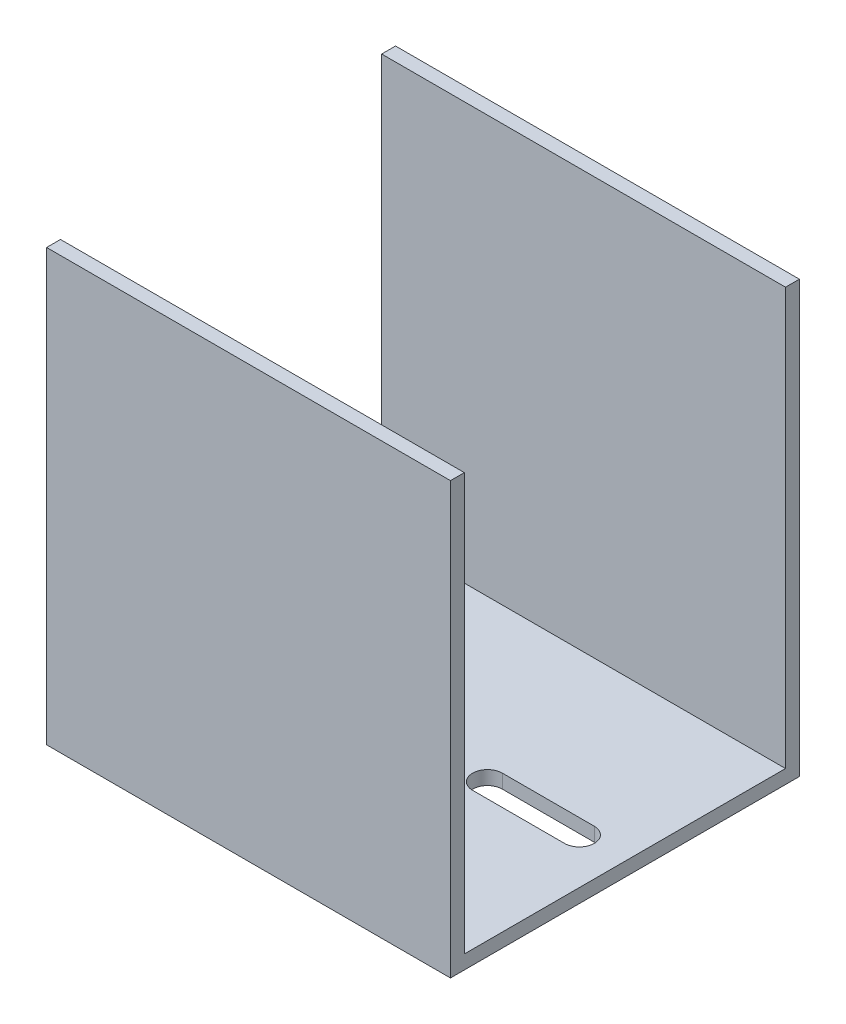
from build123d import *

# Parameters (mm, degrees)
SKETCH1_W           = 139.7
SKETCH1_H           = 111.1
SKETCH1_R           = 5.15
BOSS_EXTRUDE1_DEPTH = 4.8
SKETCH1_4_W         = 139.7
SKETCH1_4_H         = 4.8
BOSS_EXTRUDE2_DEPTH = 149


with BuildPart() as part:
    # Sketch1 → Boss-Extrude1 (new body)
    with BuildSketch(Plane(origin=(0, 0, 0), x_dir=(1, 0, 0), z_dir=(0, 1, 0))):
        with Locations((69.85, -60.35)):
            Rectangle(SKETCH1_W, SKETCH1_H)
        with BuildLine():
            ThreePointArc((7.55, -87.3), (12.7, -82.15), (17.85, -87.3))
            Line((17.85, -87.3), (17.85, -100))
            ThreePointArc((17.85, -100), (12.7, -105.15), (7.55, -100))
            Line((7.55, -100), (7.55, -87.3))
        make_face(mode=Mode.SUBTRACT)
        with Locations((12.7, -60.3)):
            Circle(SKETCH1_R, mode=Mode.SUBTRACT)
        with Locations((39.7, -60.3)):
            Circle(SKETCH1_R, mode=Mode.SUBTRACT)
        with BuildLine():
            Line((7.55, -33.3), (7.55, -20.6))
            ThreePointArc((7.55, -20.6), (12.7, -15.45), (17.85, -20.6))
            Line((17.85, -20.6), (17.85, -33.3))
            ThreePointArc((17.85, -33.3), (12.7, -38.45), (7.55, -33.3))
        make_face(mode=Mode.SUBTRACT)
        with BuildLine():
            ThreePointArc((92.1, -65.45), (86.95, -60.3), (92.1, -55.15))
            Line((92.1, -55.15), (123.9, -55.15))
            ThreePointArc((123.9, -55.15), (127.541599923, -56.658400077), (129.05, -60.3))
            ThreePointArc((129.05, -60.3), (127.541599923, -63.941599923), (123.9, -65.45))
            Line((123.9, -65.45), (92.1, -65.45))
        make_face(mode=Mode.SUBTRACT)
    extrude(amount=BOSS_EXTRUDE1_DEPTH)

    # Sketch1<4> → Boss-Extrude2 (add)
    with BuildSketch(Plane(origin=(0, 0, 0), x_dir=(1, 0, 0), z_dir=(0, 1, 0))):
        with Locations((69.85, -2.4)):
            Rectangle(SKETCH1_4_W, SKETCH1_4_H)
        with Locations((69.85, -118.3)):
            Rectangle(SKETCH1_4_W, SKETCH1_4_H)
    extrude(amount=BOSS_EXTRUDE2_DEPTH)


solid = part.part
